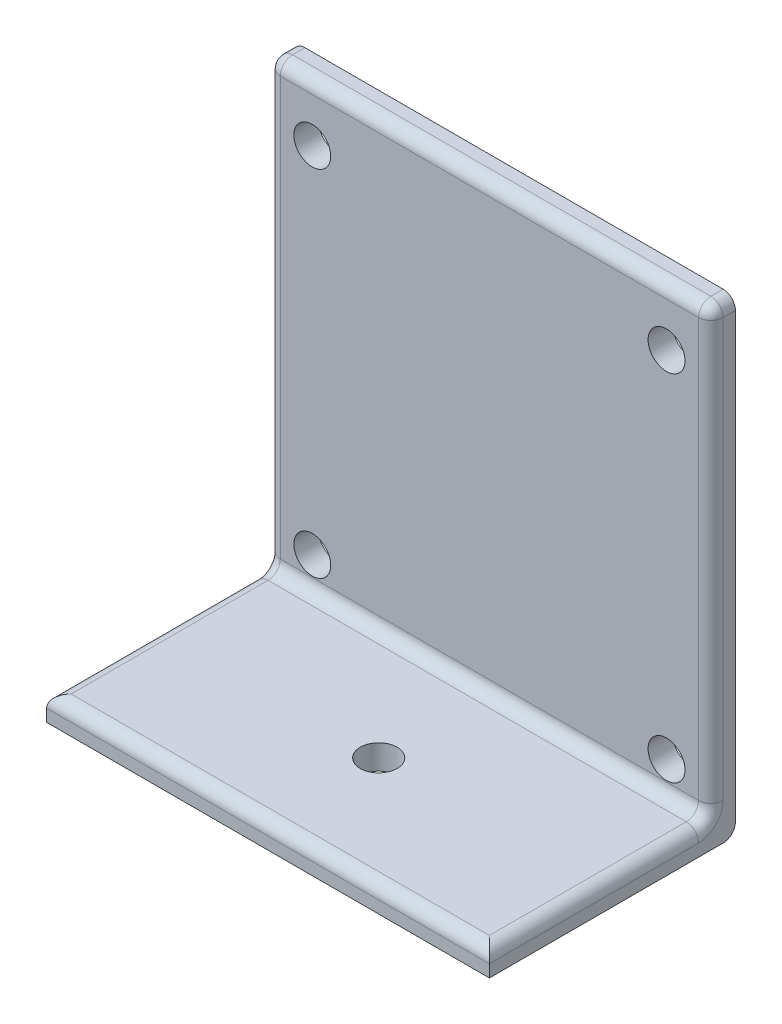
from build123d import *

# Parameters (mm, degrees)
SKETCH1_W           = 36
SKETCH1_H           = 20
BOSS_EXTRUDE1_DEPTH = 2
SKETCH2_W           = 36
SKETCH2_H           = 2
BOSS_EXTRUDE2_DEPTH = 36
CUT_EXTRUDE1_REACH  = 48.562
SKETCH3_R           = 1.5
CUT_EXTRUDE3_REACH  = 43.473
SKETCH4_R           = 1.5
FILLET1_R           = 1


with BuildPart() as part:
    # Sketch1 → Boss-Extrude1 (new body)
    with BuildSketch(Plane(origin=(0, 0, 0), x_dir=(1, 0, 0), z_dir=(0, 1, 0))):
        Rectangle(SKETCH1_W, SKETCH1_H)
    extrude(amount=BOSS_EXTRUDE1_DEPTH)

    # Sketch2 → Boss-Extrude2 (add)
    with BuildSketch(Plane(origin=(0, 2, 0), x_dir=(1, 0, 0), z_dir=(0, 1, 0))):
        with Locations((0, 9)):
            Rectangle(SKETCH2_W, SKETCH2_H)
    extrude(amount=BOSS_EXTRUDE2_DEPTH)

    # Sketch3 → Cut-Extrude1 (cut, up to next)
    with BuildSketch(Plane(origin=(0, 0, -10), x_dir=(-1, 0, 0), z_dir=(0, 0, -1)), mode=Mode.PRIVATE) as cut_extrude1_sk1:
        with Locations((-14.4, 33.4)):
            Circle(SKETCH3_R)
    cut_extrude1_tool1 = extrude(cut_extrude1_sk1.sketch, amount=-CUT_EXTRUDE1_REACH, mode=Mode.PRIVATE) & part.part
    # Sketch3 → Cut-Extrude1 (cut, up to next)
    with BuildSketch(Plane(origin=(0, 0, -10), x_dir=(-1, 0, 0), z_dir=(0, 0, -1)), mode=Mode.PRIVATE) as cut_extrude1_sk2:
        with Locations((14.4, 33.4)):
            Circle(SKETCH3_R)
    cut_extrude1_tool2 = extrude(cut_extrude1_sk2.sketch, amount=-CUT_EXTRUDE1_REACH, mode=Mode.PRIVATE) & part.part
    # Sketch3 → Cut-Extrude1 (cut, up to next)
    with BuildSketch(Plane(origin=(0, 0, -10), x_dir=(-1, 0, 0), z_dir=(0, 0, -1)), mode=Mode.PRIVATE) as cut_extrude1_sk3:
        with Locations((14.4, 4.6)):
            Circle(SKETCH3_R)
    cut_extrude1_tool3 = extrude(cut_extrude1_sk3.sketch, amount=-CUT_EXTRUDE1_REACH, mode=Mode.PRIVATE) & part.part
    # Sketch3 → Cut-Extrude1 (cut, up to next)
    with BuildSketch(Plane(origin=(0, 0, -10), x_dir=(-1, 0, 0), z_dir=(0, 0, -1)), mode=Mode.PRIVATE) as cut_extrude1_sk4:
        with Locations((-14.4, 4.6)):
            Circle(SKETCH3_R)
    cut_extrude1_tool4 = extrude(cut_extrude1_sk4.sketch, amount=-CUT_EXTRUDE1_REACH, mode=Mode.PRIVATE) & part.part
    add(cut_extrude1_tool1.solids().sort_by_distance((14.4, 33.4, -10))[0], mode=Mode.SUBTRACT)
    add(cut_extrude1_tool2.solids().sort_by_distance((-14.4, 33.4, -10))[0], mode=Mode.SUBTRACT)
    add(cut_extrude1_tool3.solids().sort_by_distance((-14.4, 4.6, -10))[0], mode=Mode.SUBTRACT)
    add(cut_extrude1_tool4.solids().sort_by_distance((14.4, 4.6, -10))[0], mode=Mode.SUBTRACT)

    # Sketch4 → Cut-Extrude3 (cut, up to next)
    with BuildSketch(Plane(origin=(0, 2, 0), x_dir=(1, 0, 0), z_dir=(0, 1, 0)), mode=Mode.PRIVATE) as cut_extrude3_sk1:
        with Locations(Location((0, -1, 0), (0, 0, 270))):
            Circle(SKETCH4_R)
    cut_extrude3_tool1 = extrude(cut_extrude3_sk1.sketch, amount=-CUT_EXTRUDE3_REACH, mode=Mode.PRIVATE) & part.part
    add(cut_extrude3_tool1.solids().sort_by_distance((0, 2, 1))[0], mode=Mode.SUBTRACT)

    # Fillet1
    fillet1_edges = [part.edges().sort_by_distance(p)[0] for p in [
        (0, 2, 10),
        (-18, 2, 1),
        (0, 2, -8),
        (-18, 20, -8),
        (18, 20, -8),
        (-18, 38, -9),
        (0, 38, -8),
        (18, 38, -9),
        (18, 2, 1),
        (0, 0, -10),
    ]]
    fillet(fillet1_edges, radius=FILLET1_R)


solid = part.part
